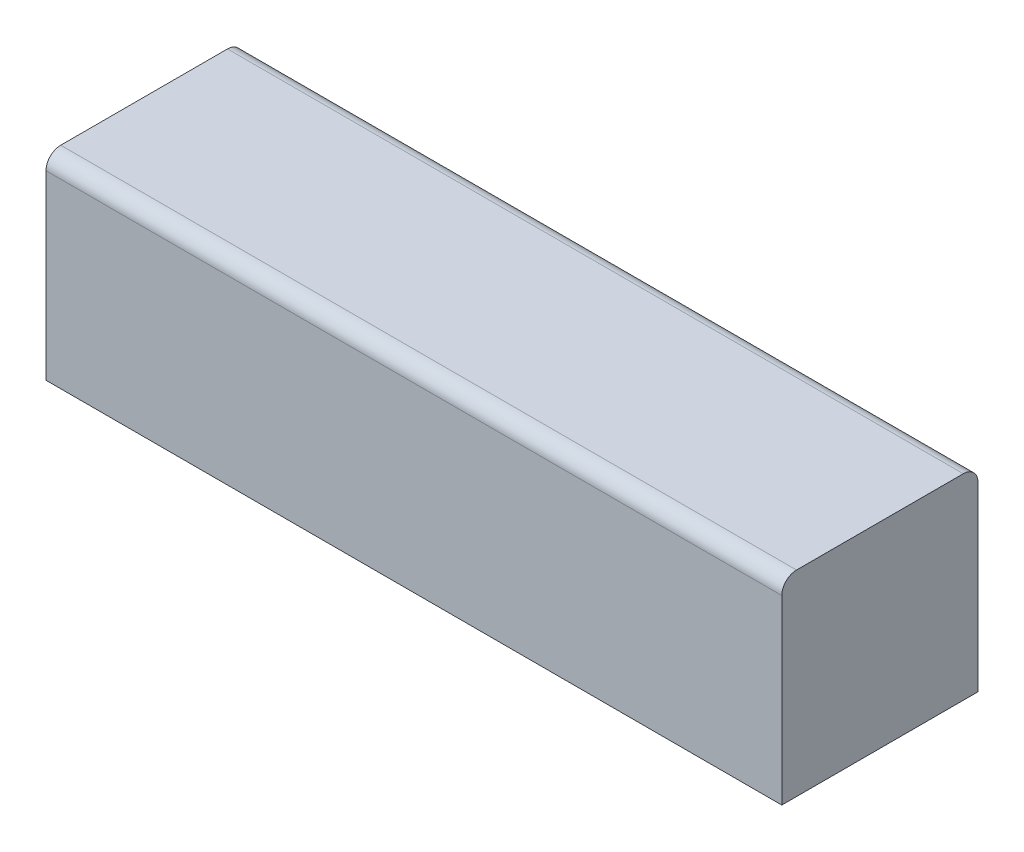
from build123d import *

# Parameters (mm, degrees)
SALIENTE_EXTRUIR1_DEPTH = 75


with BuildPart() as part:
    # Croquis1 → Saliente-Extruir1 (new, symmetric)
    with BuildSketch(Plane(origin=(0, 0, 0), x_dir=(0, 0, -1), z_dir=(1, 0, 0))):
        with BuildLine():
            Line((20, -20), (-20, -20))
            Line((-20, -20), (-20, 17))
            ThreePointArc((-20, 17), (-19.121320344, 19.121320344), (-17, 20))
            Line((-17, 20), (17, 20))
            ThreePointArc((17, 20), (19.121320344, 19.121320344), (20, 17))
            Line((20, 17), (20, -20))
        make_face()
    extrude(amount=SALIENTE_EXTRUIR1_DEPTH, both=True)


solid = part.part
